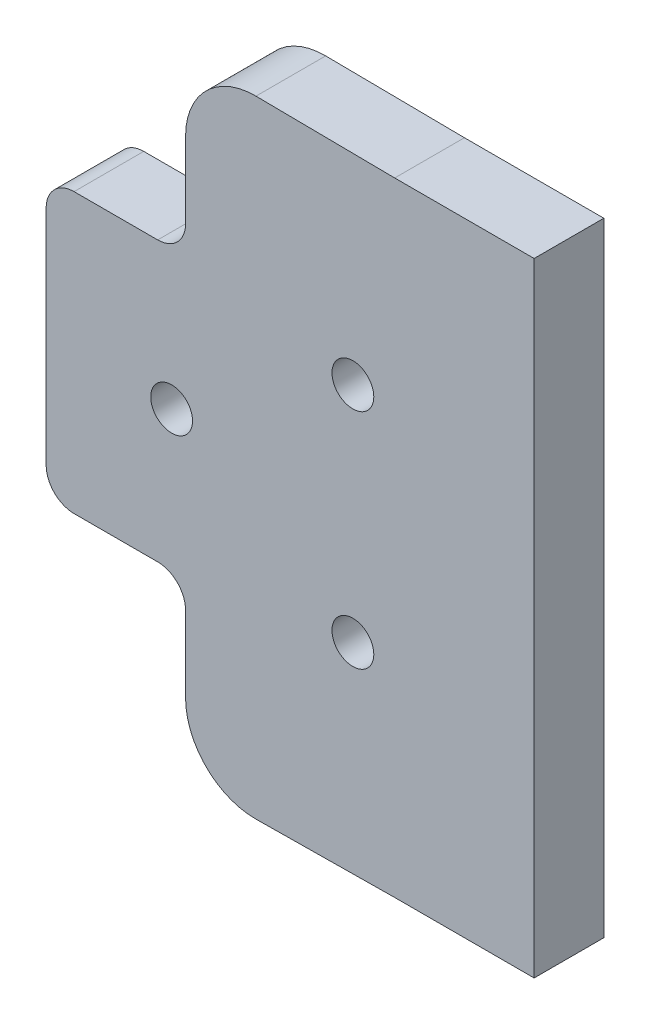
from build123d import *

# Parameters (mm, degrees)
SKETCH1_R           = 1.5
BOSS_EXTRUDE1_DEPTH = 2.5


with BuildPart() as part:
    # Sketch1 → Boss-Extrude1 (new, symmetric)
    with BuildSketch(Plane.XY):
        with BuildLine():
            Line((1.083328706, 19.876336974), (1.083328706, 14.420285823))
            ThreePointArc((1.083328706, 14.420285823), (0.497542269, 13.006072261), (-0.916671294, 12.420285823))
            Line((-0.916671294, 12.420285823), (-6.916671294, 12.420285823))
            ThreePointArc((-6.916671294, 12.420285823), (-8.330884856, 11.834499385), (-8.916671294, 10.420285823))
            Line((-8.916671294, 10.420285823), (-8.916671294, -5.579714177))
            ThreePointArc((-8.916671294, -5.579714177), (-8.330884856, -6.993927739), (-6.916671294, -7.579714177))
            Line((-6.916671294, -7.579714177), (-0.916671294, -7.579714177))
            ThreePointArc((-0.916671294, -7.579714177), (0.497542269, -8.165500615), (1.083328706, -9.579714177))
            Line((1.083328706, -9.579714177), (1.083328706, -15.035765328))
            ThreePointArc((1.083328706, -15.035765328), (2.564962353, -18.588383827), (6.131767987, -20.035530686))
            add(Edge.make_bspline(
                [(6.131767987, -20.035530686), (9.248092377, -20.005338767), (12.570832777, -19.968565053), (16.083328706, -19.927626228)],
                knots=[0.046327938, 0.046327938, 0.046327938, 0.046327938, 0.128883425, 0.128883425, 0.128883425, 0.128883425], degree=3))
            Line((16.083328706, -19.927626228), (26.083328706, -19.927626228))
            Line((26.083328706, -19.927626228), (26.083328706, 24.768197874))
            Line((26.083328706, 24.768197874), (16.083328706, 24.768197874))
            add(Edge.make_bspline(
                [(16.083328706, 24.768197874), (12.570832777, 24.809136699), (9.248092377, 24.845910412), (6.131767987, 24.876102332)],
                knots=[0.046327938, 0.046327938, 0.046327938, 0.046327938, 0.128883425, 0.128883425, 0.128883425, 0.128883425], degree=3))
            ThreePointArc((6.131767987, 24.876102332), (2.564962353, 23.428955473), (1.083328706, 19.876336974))
        make_face()
        with Locations((13.083328706, 10.420285823)):
            Circle(SKETCH1_R, mode=Mode.SUBTRACT)
        with Locations((0.083328706, 2.420285823)):
            Circle(SKETCH1_R, mode=Mode.SUBTRACT)
        with Locations((13.083328706, -5.579714177)):
            Circle(SKETCH1_R, mode=Mode.SUBTRACT)
    extrude(amount=BOSS_EXTRUDE1_DEPTH, both=True)


solid = part.part
